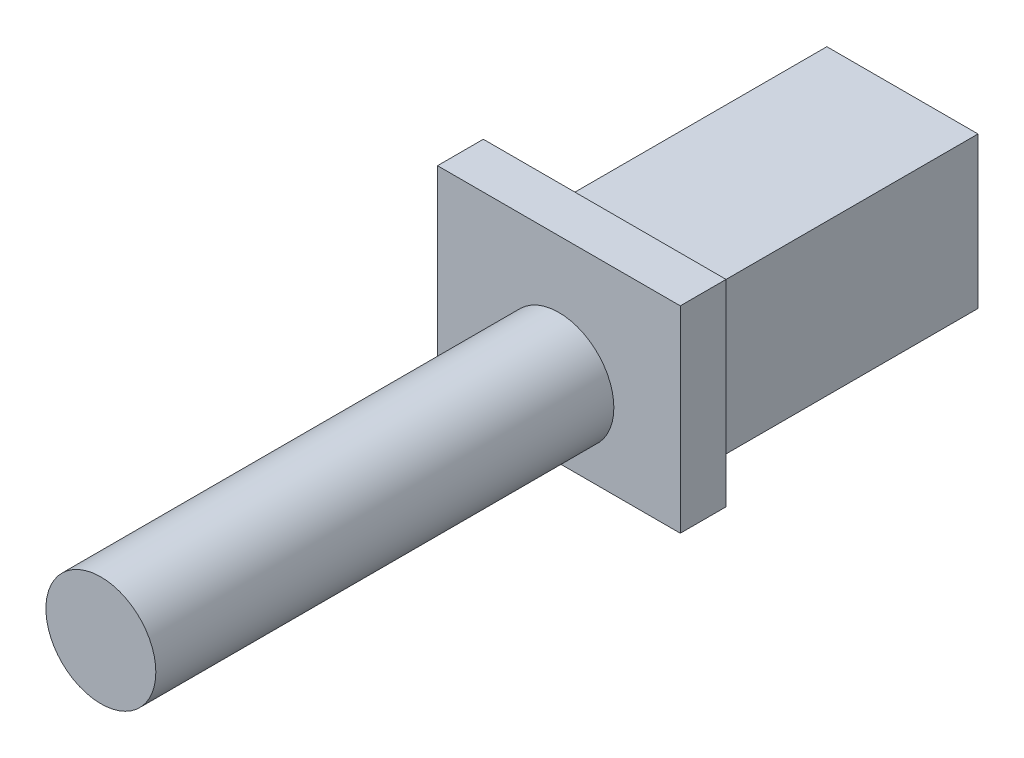
from build123d import *

# Parameters (mm, degrees)
SKETCH3_R           = 2.4
BOSS_EXTRUDE1_DEPTH = 20
SKETCH3_4_W         = 6.6
SKETCH3_4_H         = 6.6
BOSS_EXTRUDE2_DEPTH = 15
BOSS_EXTRUDE3_DEPTH = 2


with BuildPart() as part:
    # Sketch3 → Boss-Extrude1 (new body)
    with BuildSketch(Plane.XY):
        Circle(SKETCH3_R)
    extrude(amount=BOSS_EXTRUDE1_DEPTH)

    # Sketch3<4> → Boss-Extrude2 (add)
    with BuildSketch(Plane.XY):
        Rectangle(SKETCH3_4_W, SKETCH3_4_H)
    extrude(amount=-BOSS_EXTRUDE2_DEPTH)

    # Sketch3<5> → Boss-Extrude3 (add)
    with BuildSketch(Plane.XY):
        Polygon((-5.3, -3.3), (-3.3, -3.3), (-3.3, 3.3), (3.3, 3.3), (3.3, -3.3), (5.3, -3.3), (5.3, 5.3), (-5.3, 5.3), align=None)
    extrude(amount=-BOSS_EXTRUDE3_DEPTH)


solid = part.part
